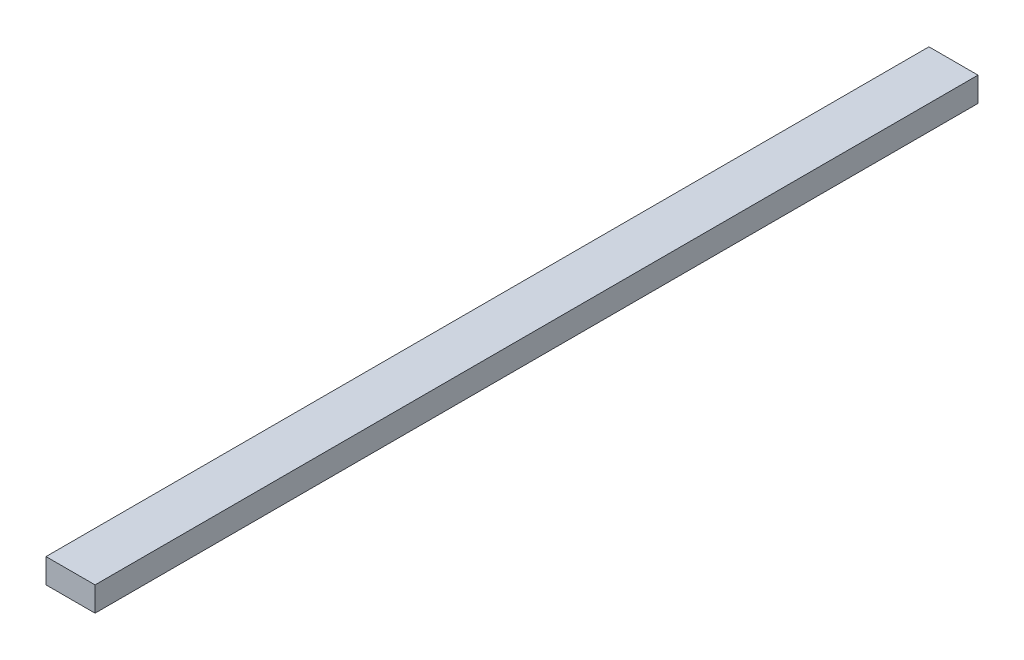
from build123d import *

# Parameters (mm, degrees)
SKETCH1_W           = 101.6
SKETCH1_H           = 50.8
BOSS_EXTRUDE1_DEPTH = 1828.8


with BuildPart() as part:
    # Sketch1 → Boss-Extrude1 (new body)
    with BuildSketch(Plane.XY):
        with Locations((50.8, 25.4)):
            Rectangle(SKETCH1_W, SKETCH1_H)
    extrude(amount=BOSS_EXTRUDE1_DEPTH)


solid = part.part
